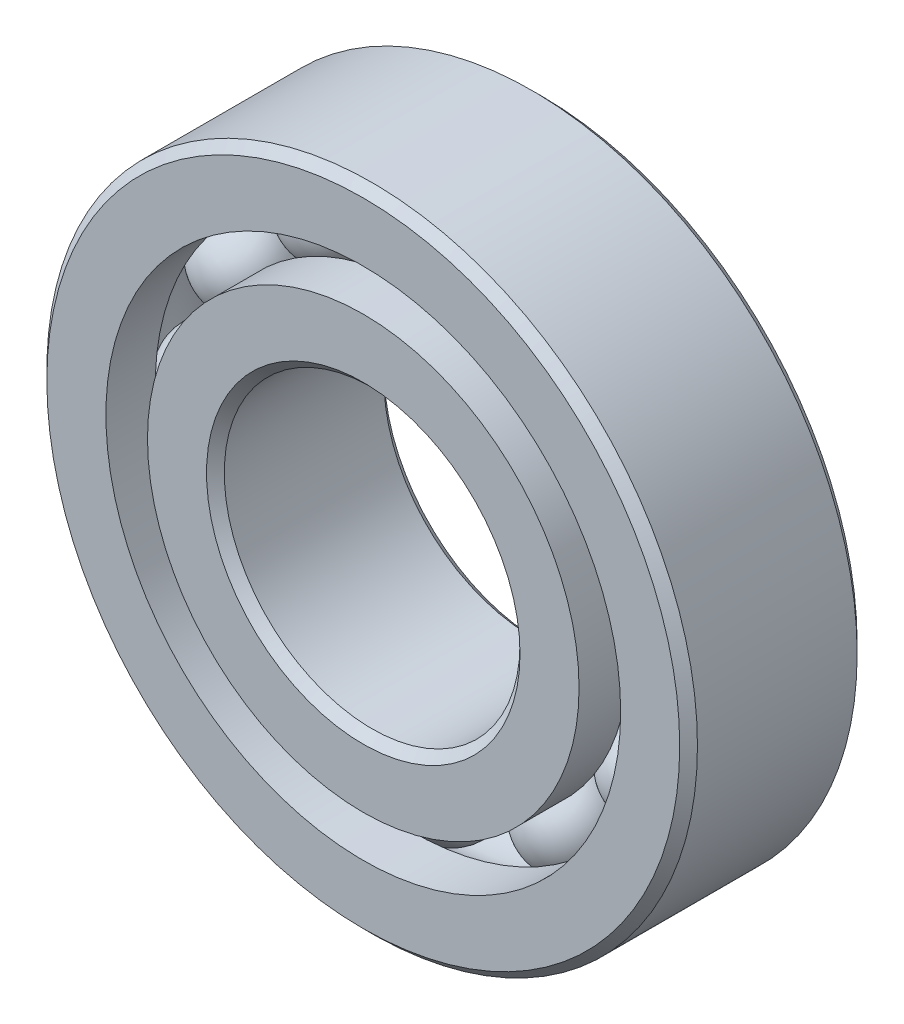
from build123d import *

# Parameters (mm, degrees)
CIRPATTERN1_COUNT = 12


with BuildPart() as part:
    # Sketch1 → Revolve1 (revolve)
    with BuildSketch(Plane(origin=(0, 0, 0), x_dir=(0, 0, -1), z_dir=(1, 0, 0))):
        with BuildLine():
            Line((2.7, 11), (-2.7, 11))
            Line((-2.7, 11), (-3, 10.7))
            Line((-3, 10.7), (-3, 8.703296703))
            Line((-3, 8.703296703), (-1.333333333, 8.703296703))
            ThreePointArc((-1.333333333, 8.703296703), (0, 9.507449512), (1.333333333, 8.703296703))
            Line((1.333333333, 8.703296703), (3, 8.703296703))
            Line((3, 8.703296703), (3, 10.7))
            Line((3, 10.7), (2.7, 11))
        make_face()
    revolve(axis=Axis((0, 0, 3), (0, 0, -1)))


with BuildPart() as body_2:
    # Sketch3 → Revolve3 (revolve)
    with BuildSketch(Plane(origin=(0, 0, 0), x_dir=(0, 0, -1), z_dir=(1, 0, 0))):
        with BuildLine():
            Line((-3, 7.296703297), (-1.333333333, 7.296703297))
            ThreePointArc((-1.333333333, 7.296703297), (0, 6.492550488), (1.333333333, 7.296703297))
            Line((1.333333333, 7.296703297), (3, 7.296703297))
            Line((3, 7.296703297), (3, 5.3))
            Line((3, 5.3), (2.7, 5))
            Line((2.7, 5), (-2.7, 5))
            Line((-2.7, 5), (-3, 5.3))
            Line((-3, 5.3), (-3, 7.296703297))
        make_face()
    revolve(axis=Axis((0, 0, 3), (0, 0, -1)))


with BuildPart() as body_3:
    # Sketch4 → Revolve4 (revolve)
    with BuildSketch(Plane(origin=(0, 0, 0), x_dir=(0, 0, -1), z_dir=(1, 0, 0))):
        with BuildLine():
            Line((-1.507449512, 8), (1.507449512, 8))
            ThreePointArc((1.507449512, 8), (0, 9.507449512), (-1.507449512, 8))
        make_face()
    revolve(axis=Axis((0, 8, 1.507449512), (0, 0, -1)))


with BuildPart() as cirpattern1_1:
    # CirPattern1: pattern copy
    add(body_3.part.rotate(Axis((0, 0, -3), (0, 0, 1)), 1 * 360 / CIRPATTERN1_COUNT))


with BuildPart() as cirpattern1_2:
    # CirPattern1: pattern copy
    add(body_3.part.rotate(Axis((0, 0, -3), (0, 0, 1)), 2 * 360 / CIRPATTERN1_COUNT))


with BuildPart() as cirpattern1_3:
    # CirPattern1: pattern copy
    add(body_3.part.rotate(Axis((0, 0, -3), (0, 0, 1)), 3 * 360 / CIRPATTERN1_COUNT))


with BuildPart() as cirpattern1_4:
    # CirPattern1: pattern copy
    add(body_3.part.rotate(Axis((0, 0, -3), (0, 0, 1)), 4 * 360 / CIRPATTERN1_COUNT))


with BuildPart() as cirpattern1_5:
    # CirPattern1: pattern copy
    add(body_3.part.rotate(Axis((0, 0, -3), (0, 0, 1)), 5 * 360 / CIRPATTERN1_COUNT))


with BuildPart() as cirpattern1_6:
    # CirPattern1: pattern copy
    add(body_3.part.rotate(Axis((0, 0, -3), (0, 0, 1)), 6 * 360 / CIRPATTERN1_COUNT))


with BuildPart() as cirpattern1_7:
    # CirPattern1: pattern copy
    add(body_3.part.rotate(Axis((0, 0, -3), (0, 0, 1)), 7 * 360 / CIRPATTERN1_COUNT))


with BuildPart() as cirpattern1_8:
    # CirPattern1: pattern copy
    add(body_3.part.rotate(Axis((0, 0, -3), (0, 0, 1)), 8 * 360 / CIRPATTERN1_COUNT))


with BuildPart() as cirpattern1_9:
    # CirPattern1: pattern copy
    add(body_3.part.rotate(Axis((0, 0, -3), (0, 0, 1)), 9 * 360 / CIRPATTERN1_COUNT))


with BuildPart() as cirpattern1_10:
    # CirPattern1: pattern copy
    add(body_3.part.rotate(Axis((0, 0, -3), (0, 0, 1)), 10 * 360 / CIRPATTERN1_COUNT))


with BuildPart() as cirpattern1_11:
    # CirPattern1: pattern copy
    add(body_3.part.rotate(Axis((0, 0, -3), (0, 0, 1)), 11 * 360 / CIRPATTERN1_COUNT))


solid = Compound([part.part, body_2.part, body_3.part, cirpattern1_1.part, cirpattern1_2.part, cirpattern1_3.part, cirpattern1_4.part, cirpattern1_5.part, cirpattern1_6.part, cirpattern1_7.part, cirpattern1_8.part, cirpattern1_9.part, cirpattern1_10.part, cirpattern1_11.part])
